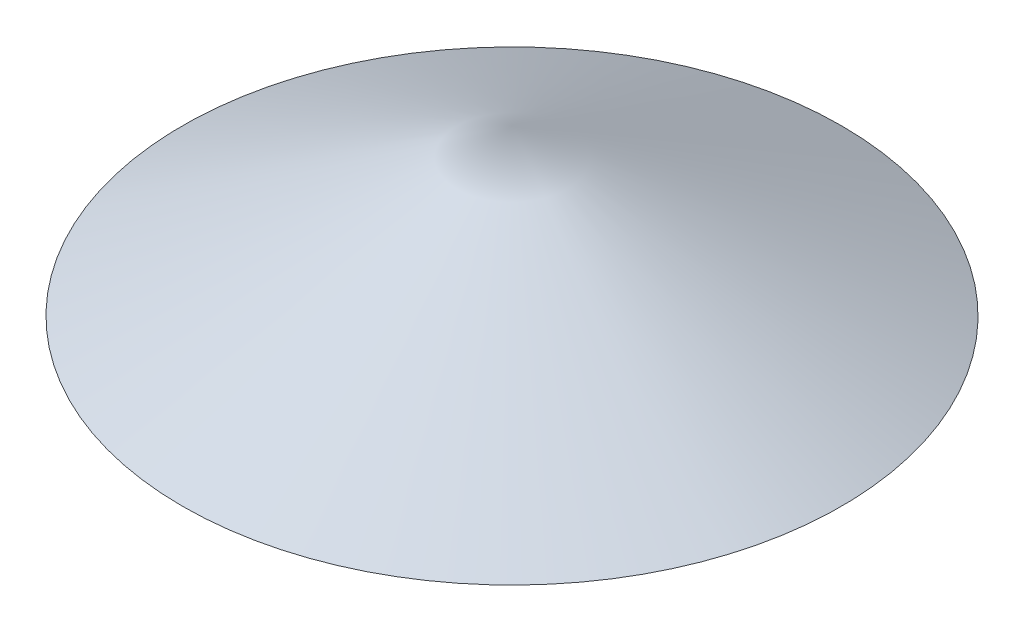
from build123d import *


with BuildPart() as part:
    # Sketch1 → Revolve1 (revolve)
    with BuildSketch(Plane.XY, mode=Mode.PRIVATE) as revolve1_sk:
        Polygon((0, 0), (30, 0), (0, 15), align=None)
    revolve(revolve1_sk.sketch.rotate(Axis((0, 15, 0), (0, -1, 0)), 270), axis=Axis((0, 15, 0), (0, -1, 0)))


solid = part.part
